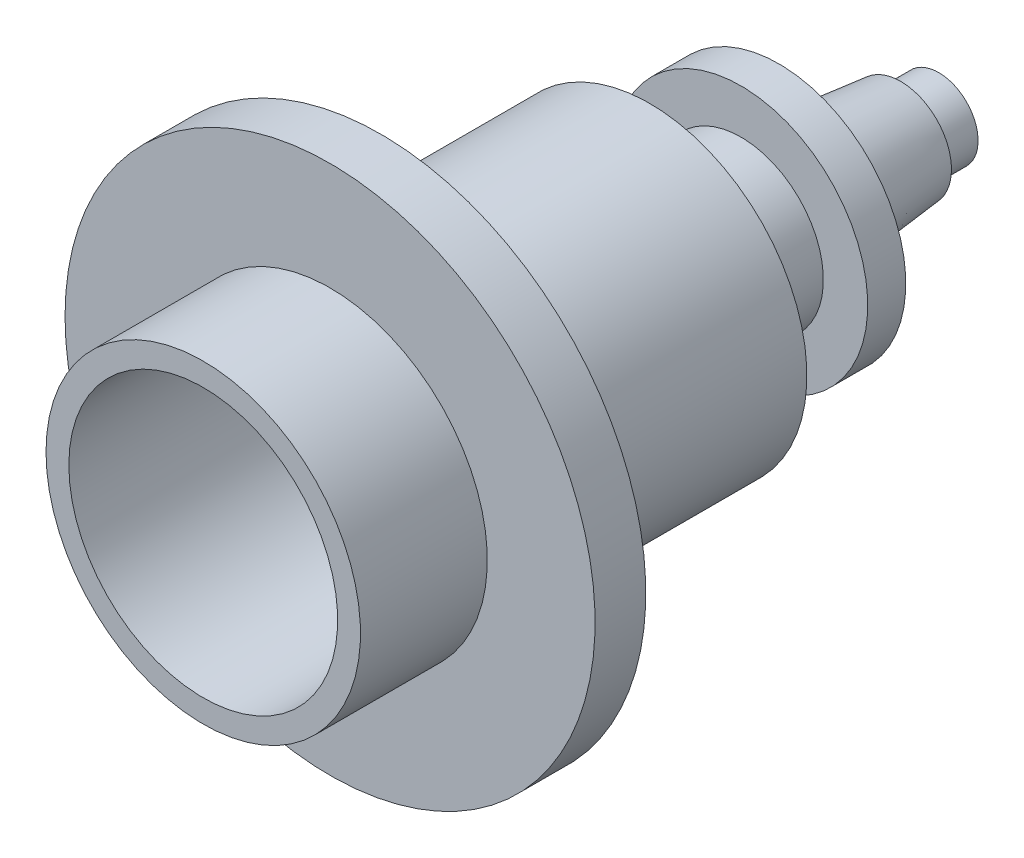
from build123d import *


with BuildPart() as part:
    # Body Sketch → Body Revolve (revolve)
    with BuildSketch(Plane(origin=(0, 0, 0), x_dir=(1, 0, 0), z_dir=(0, 1, 0)), mode=Mode.PRIVATE) as body_revolve_sk:
        Polygon((2.65, -14.5), (3.1, -14.5), (3.1, -12), (5.225, -12), (5.225, -11), (3.1, -11), (3.1, -5.7), (1.625, -5.3), (1.625, -3.9), (2.5, -3.9), (2.5, -3.15), (1.25, -3.15), (1, -0.75), (0.775, -0.75), (0.775, 0), (0.25, 0), (0.25, -5.704207714), (2.65, -6.355055172), align=None)
    revolve(body_revolve_sk.sketch.rotate(Axis((0, 0, 0), (0, 0, 1)), 180), axis=Axis((0, 0, 0), (0, 0, 1)))


solid = part.part
